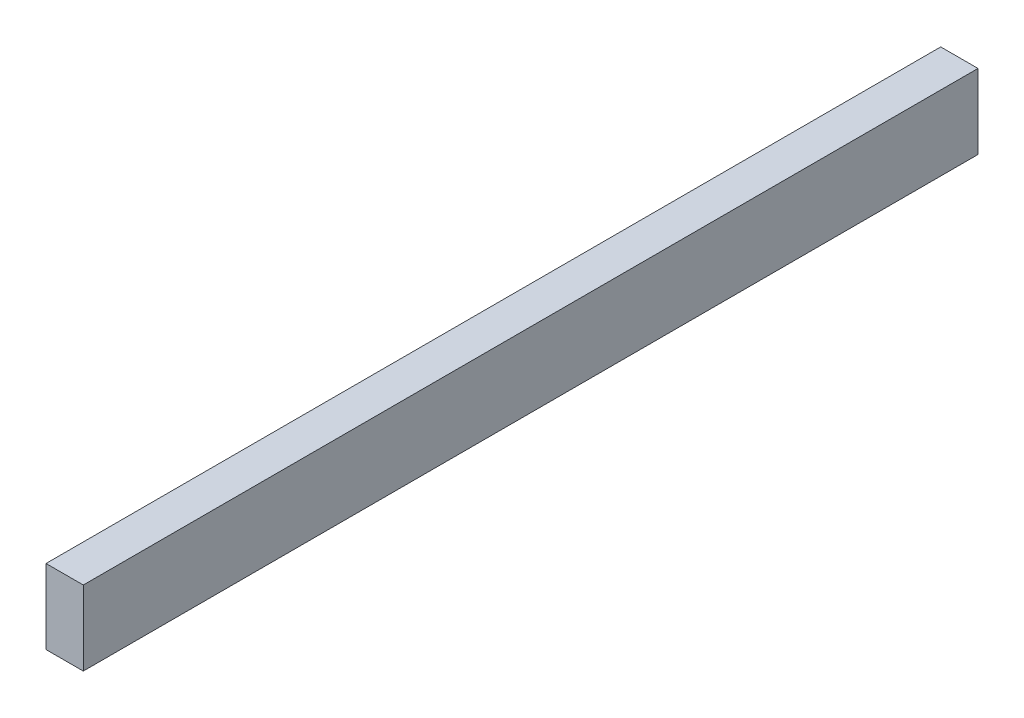
from build123d import *

# Parameters (mm, degrees)
SKETCH1_W           = 50.8
SKETCH1_H           = 101.6
BOSS_EXTRUDE1_DEPTH = 1219.2


with BuildPart() as part:
    # Sketch1 → Boss-Extrude1 (new body)
    with BuildSketch(Plane.XY):
        Rectangle(SKETCH1_W, SKETCH1_H)
    extrude(amount=BOSS_EXTRUDE1_DEPTH)


solid = part.part
